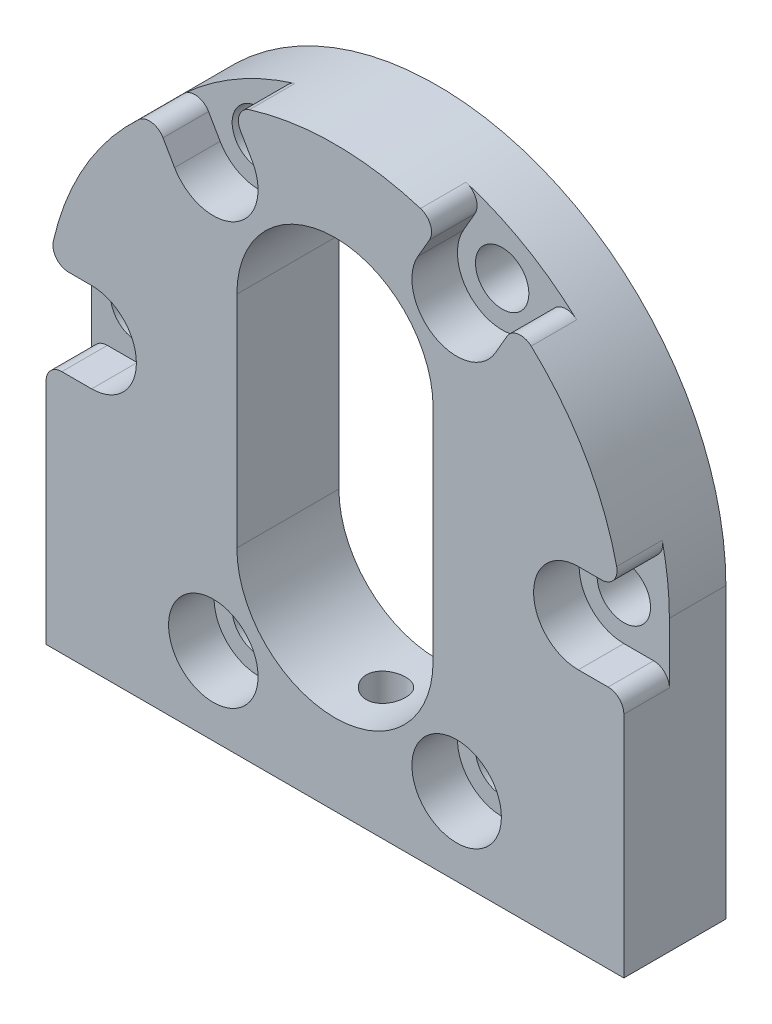
from build123d import *

# Parameters (mm, degrees)
BOSS_EXTRUDE1_DEPTH             = 3.25
CBORE_FOR_M3_SBHCS1_D           = 3.4
CBORE_FOR_M3_SBHCS1_CBORE_D     = 5.7
CBORE_FOR_M3_SBHCS1_CBORE_DEPTH = 2.9
SKETCH6_W                       = 2.9
SKETCH6_H                       = 5.7
CUT_EXTRUDE1_DEPTH              = 42.300847449
M3X0_5_TAPPED_HOLE1_D           = 2.5
M3X0_5_TAPPED_HOLE1_DEPTH       = 8
M3X0_5_TAPPED_HOLE1_TIP         = 0.751075774
FILLET1_R                       = 1


with BuildPart() as part:
    # Sketch1 → Boss-Extrude1 (new, symmetric)
    with BuildSketch(Plane.XY):
        with BuildLine():
            Line((-18.4, 18.4), (-18.4, 0))
            Line((-18.4, 0), (18.4, 0))
            Line((18.4, 0), (18.4, 18.4))
            ThreePointArc((18.4, 18.4), (0, 36.8), (-18.4, 18.4))
        make_face()
        with BuildLine():
            Line((6.25, 25.4), (6.25, 11.4))
            ThreePointArc((6.25, 11.4), (0, 5.15), (-6.25, 11.4))
            Line((-6.25, 11.4), (-6.25, 25.4))
            ThreePointArc((-6.25, 25.4), (0, 31.65), (6.25, 25.4))
        make_face(mode=Mode.SUBTRACT)
    extrude(amount=BOSS_EXTRUDE1_DEPTH, both=True)

    # CBORE for M3 SBHCS1 (through all)
    with Locations(Plane.XY.offset(3.25)):
        with Locations((7.75, 4.976606241), (15.5, 18.4), (7.75, 31.823393759), (-7.75, 31.823393759), (-15.5, 18.4), (-7.75, 4.976606241)):
            CounterBoreHole(CBORE_FOR_M3_SBHCS1_D / 2, CBORE_FOR_M3_SBHCS1_CBORE_D / 2, CBORE_FOR_M3_SBHCS1_CBORE_DEPTH)

    # Sketch6 → Cut-Extrude1 (cut, through all)
    with BuildSketch(Plane.XY.offset(0.35)):
        with Locations((-16.95, 18.4)):
            Rectangle(SKETCH6_W, SKETCH6_H)
        with Locations((16.95, 18.4)):
            Rectangle(SKETCH6_W, SKETCH6_H)
        Polygon((-10.218172401, 30.398393759), (-11.674711226, 32.921193007), (-6.725476951, 35.748867784), (-5.281827599, 33.248393759), align=None)
        Polygon((5.281827599, 33.248393759), (6.731827599, 35.75986743), (11.668172401, 32.90986743), (10.218172401, 30.398393759), align=None)
    extrude(amount=CUT_EXTRUDE1_DEPTH, mode=Mode.SUBTRACT)

    # M3x0.5 Tapped Hole1
    with Locations(Plane(origin=(0, 0, 0), x_dir=(-1, 0, 0), z_dir=(0, -1, 0))):
        with Locations((14.8, 0), (0, 0), (-14.8, 0)):
            Hole(M3X0_5_TAPPED_HOLE1_D / 2, depth=M3X0_5_TAPPED_HOLE1_DEPTH)
            with Locations((0, 0, -(M3X0_5_TAPPED_HOLE1_DEPTH + M3X0_5_TAPPED_HOLE1_TIP / 2))):  # 118° drill point
                Cone(0, M3X0_5_TAPPED_HOLE1_D / 2, M3X0_5_TAPPED_HOLE1_TIP, mode=Mode.SUBTRACT)

    # Fillet1
    fillet1_edges = [part.edges().sort_by_distance(p)[0] for p in [
        (-18.177939927, 21.25, 1.8),
        (-18.4, 15.55, 1.8),
        (11.557142364, 32.717557765, 1.8),
        (6.620797563, 35.567557765, 1.8),
        (-6.620797563, 35.567557765, 1.8),
        (-11.557142364, 32.717557765, 1.8),
        (18.4, 15.55, 1.8),
        (18.177939927, 21.25, 1.8),
    ]]
    fillet(fillet1_edges, radius=FILLET1_R)


solid = part.part
